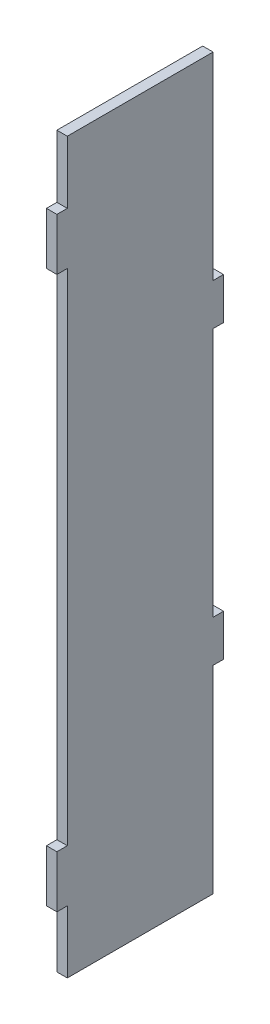
from build123d import *

# Parameters (mm, degrees)
BOSS_EXTRUDE1_DEPTH = 5


with BuildPart() as part:
    # Sketch1 → Boss-Extrude1 (new body)
    with BuildSketch(Plane(origin=(0, 0, 0), x_dir=(0, 0, -1), z_dir=(1, 0, 0))):
        Polygon((-61.604826453, 16.382366839), (-61.604826453, -8.617633161), (-56.604826453, -8.617633161), (-56.604826453, -38.617633161), (13.395173547, -38.617633161), (13.395173547, 56.382366839), (18.395173547, 56.382366839), (18.395173547, 76.382366839), (13.395173547, 76.382366839), (13.395173547, 196.382366839), (18.395173547, 196.382366839), (18.395173547, 216.382366839), (13.395173547, 216.382366839), (13.395173547, 311.382366839), (-56.604826453, 311.382366839), (-56.604826453, 281.382366839), (-61.604826453, 281.382366839), (-61.604826453, 256.382366839), (-56.604826453, 256.382366839), (-56.604826453, 16.382366839), align=None)
    extrude(amount=BOSS_EXTRUDE1_DEPTH)


solid = part.part
